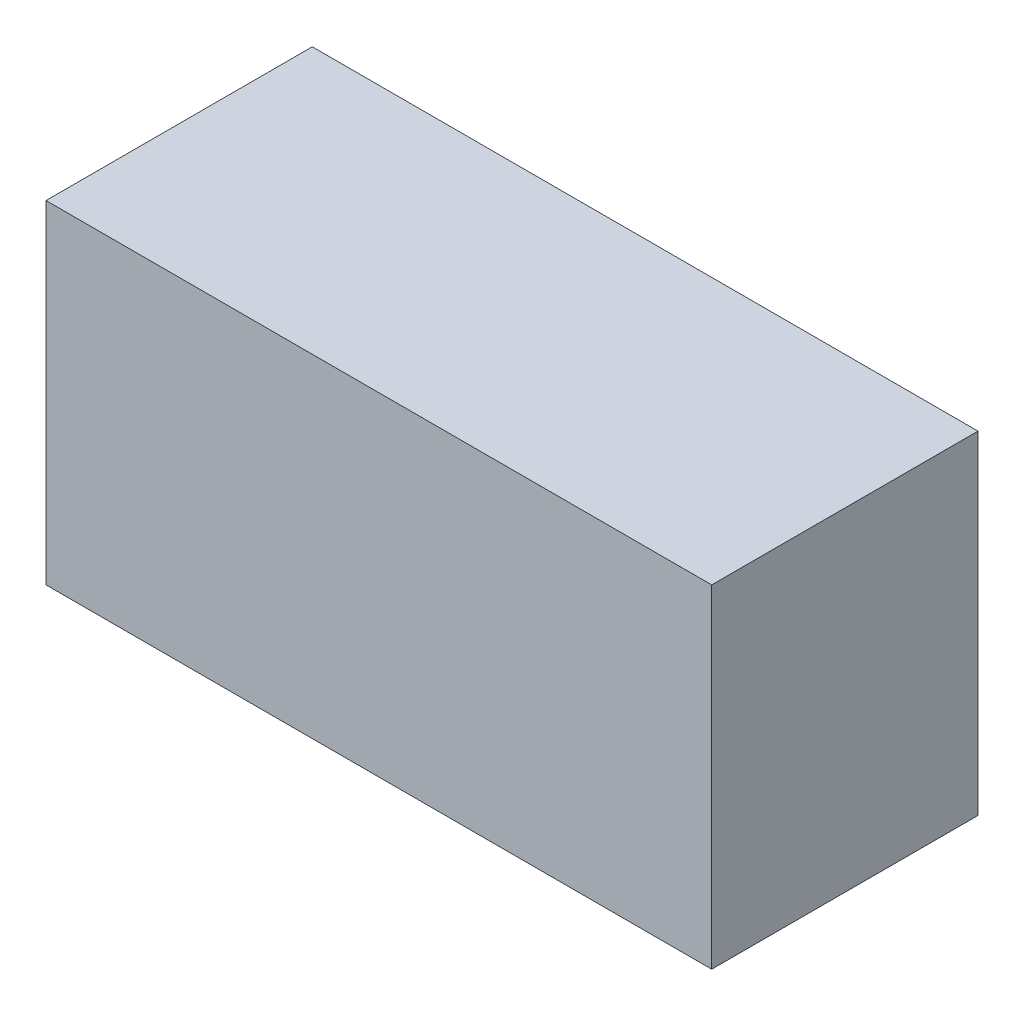
from build123d import *

# Parameters (mm, degrees)
SKETCH1_W           = 20
SKETCH1_H           = 10
BOSS_EXTRUDE1_DEPTH = 8


with BuildPart() as part:
    # Sketch1 → Boss-Extrude1 (new body)
    with BuildSketch(Plane.XY):
        with Locations((-4.035714286, -1.017857143)):
            Rectangle(SKETCH1_W, SKETCH1_H)
    extrude(amount=BOSS_EXTRUDE1_DEPTH)


solid = part.part
